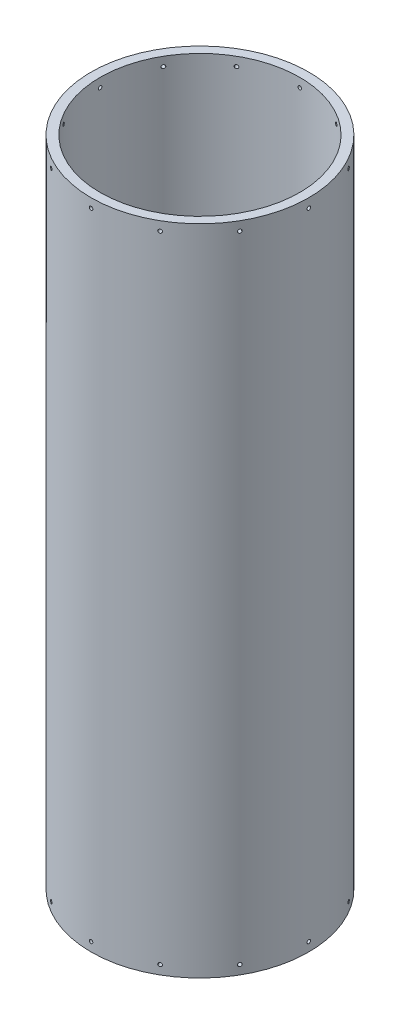
from build123d import *

# Parameters (mm, degrees)
SKETCH1_R                         = 152.4
SKETCH1_R_2                       = 139.7
BOSS_EXTRUDE1_DEPTH               = 914.4
F_10_0_1935_DIAMETER_HOLE1_REACH  = 977.836
F_10_0_1935_DIAMETER_HOLE1_BORE_R = 2.45745
CIRPATTERN1_COUNT                 = 12
MIRROR1_COPY_1_REACH              = 977.836
MIRROR1_COPY_1_SKETCH_R           = 2.45745
MIRROR1_COPY_2_REACH              = 977.836
MIRROR1_COPY_2_SKETCH_R           = 2.45745
MIRROR1_COPY_3_REACH              = 977.836
MIRROR1_COPY_3_SKETCH_R           = 2.45745
MIRROR1_COPY_4_REACH              = 977.836
MIRROR1_COPY_4_SKETCH_R           = 2.45745
MIRROR1_COPY_5_REACH              = 977.836
MIRROR1_COPY_5_SKETCH_R           = 2.45745
MIRROR1_COPY_6_REACH              = 977.836
MIRROR1_COPY_6_SKETCH_R           = 2.45745
MIRROR1_COPY_7_REACH              = 977.836
MIRROR1_COPY_7_SKETCH_R           = 2.45745
MIRROR1_COPY_8_REACH              = 977.836
MIRROR1_COPY_8_SKETCH_R           = 2.45745
MIRROR1_COPY_9_REACH              = 977.836
MIRROR1_COPY_9_SKETCH_R           = 2.45745
MIRROR1_COPY_10_REACH             = 977.836
MIRROR1_COPY_10_SKETCH_R          = 2.45745
MIRROR1_COPY_11_REACH             = 977.836
MIRROR1_COPY_11_SKETCH_R          = 2.45745


with BuildPart() as part:
    # Sketch1 → Boss-Extrude1 (new body)
    with BuildSketch(Plane(origin=(0, 0, 0), x_dir=(1, 0, 0), z_dir=(0, 1, 0))):
        with Locations(Location((0, 0, 0), (0, 0, 270))):
            Circle(SKETCH1_R)
        with Locations(Location((0, 0, 0), (0, 0, 270))):
            Circle(SKETCH1_R_2, mode=Mode.SUBTRACT)
    extrude(amount=BOSS_EXTRUDE1_DEPTH)

    # #10 (0.1935) Diameter Hole1 bore → #10 (0.1935) Diameter Hole1 (cut, up to next)
    with BuildSketch(Plane.ZY.offset(152.4), mode=Mode.PRIVATE) as f_10_0_1935_diameter_hole1_sk1:
        with Locations((0, 901.7)):
            Circle(F_10_0_1935_DIAMETER_HOLE1_BORE_R)
    f_10_0_1935_diameter_hole1_tool1 = extrude(f_10_0_1935_diameter_hole1_sk1.sketch, amount=-F_10_0_1935_DIAMETER_HOLE1_REACH, mode=Mode.PRIVATE) & part.part
    f_10_0_1935_diameter_hole1 = f_10_0_1935_diameter_hole1_tool1.solids().sort_by_distance((-152.4, 901.7, 0))[0]
    add(f_10_0_1935_diameter_hole1, mode=Mode.SUBTRACT)

    # CirPattern1: #10 (0.1935) Diameter Hole1 ×12 about axis
    cirpattern1_axis = Axis((0, 914.4, 0), (0, 1, 0))
    for i in range(1, CIRPATTERN1_COUNT):
        add(f_10_0_1935_diameter_hole1.rotate(cirpattern1_axis, i * 360 / CIRPATTERN1_COUNT), mode=Mode.SUBTRACT)

    # Mirror1: #10 (0.1935) Diameter Hole1 across plane
    add(f_10_0_1935_diameter_hole1.mirror(Plane.ZX.offset(457.2)), mode=Mode.SUBTRACT)

    # Mirror1 copy 1 sketch → Mirror1 copy 1 (cut, up to next)
    with BuildSketch(Plane(origin=(-131.982271537, 914.4, 76.2), x_dir=(0.49999999999999994, 0, 0.8660254037844387), z_dir=(-0.8660254037844387, 0, 0.49999999999999994)), mode=Mode.PRIVATE) as mirror1_copy_1_sk1:
        with Locations((0, -901.7)):
            Circle(MIRROR1_COPY_1_SKETCH_R)
    mirror1_copy_1_tool1 = extrude(mirror1_copy_1_sk1.sketch, amount=-MIRROR1_COPY_1_REACH, mode=Mode.PRIVATE) & part.part
    add(mirror1_copy_1_tool1.solids().sort_by_distance((-131.982271537, 12.7, 76.2))[0], mode=Mode.SUBTRACT)

    # Mirror1 copy 2 sketch → Mirror1 copy 2 (cut, up to next)
    with BuildSketch(Plane(origin=(-76.2, 914.4, 131.982271537), x_dir=(0.8660254037844386, 0, 0.5000000000000001), z_dir=(-0.5000000000000001, 0, 0.8660254037844386)), mode=Mode.PRIVATE) as mirror1_copy_2_sk1:
        with Locations((0, -901.7)):
            Circle(MIRROR1_COPY_2_SKETCH_R)
    mirror1_copy_2_tool1 = extrude(mirror1_copy_2_sk1.sketch, amount=-MIRROR1_COPY_2_REACH, mode=Mode.PRIVATE) & part.part
    add(mirror1_copy_2_tool1.solids().sort_by_distance((-76.2, 12.7, 131.982271537))[0], mode=Mode.SUBTRACT)

    # Mirror1 copy 3 sketch → Mirror1 copy 3 (cut, up to next)
    with BuildSketch(Plane(origin=(0, 914.4, 152.4), x_dir=(1, 0, 0), z_dir=(0, 0, 1)), mode=Mode.PRIVATE) as mirror1_copy_3_sk1:
        with Locations((0, -901.7)):
            Circle(MIRROR1_COPY_3_SKETCH_R)
    mirror1_copy_3_tool1 = extrude(mirror1_copy_3_sk1.sketch, amount=-MIRROR1_COPY_3_REACH, mode=Mode.PRIVATE) & part.part
    add(mirror1_copy_3_tool1.solids().sort_by_distance((0, 12.7, 152.4))[0], mode=Mode.SUBTRACT)

    # Mirror1 copy 4 sketch → Mirror1 copy 4 (cut, up to next)
    with BuildSketch(Plane(origin=(76.2, 914.4, 131.982271537), x_dir=(0.8660254037844387, 0, -0.4999999999999998), z_dir=(0.4999999999999998, 0, 0.8660254037844387)), mode=Mode.PRIVATE) as mirror1_copy_4_sk1:
        with Locations((0, -901.7)):
            Circle(MIRROR1_COPY_4_SKETCH_R)
    mirror1_copy_4_tool1 = extrude(mirror1_copy_4_sk1.sketch, amount=-MIRROR1_COPY_4_REACH, mode=Mode.PRIVATE) & part.part
    add(mirror1_copy_4_tool1.solids().sort_by_distance((76.2, 12.7, 131.982271537))[0], mode=Mode.SUBTRACT)

    # Mirror1 copy 5 sketch → Mirror1 copy 5 (cut, up to next)
    with BuildSketch(Plane(origin=(131.982271537, 914.4, 76.2), x_dir=(0.49999999999999994, 0, -0.8660254037844387), z_dir=(0.8660254037844387, 0, 0.49999999999999994)), mode=Mode.PRIVATE) as mirror1_copy_5_sk1:
        with Locations((0, -901.7)):
            Circle(MIRROR1_COPY_5_SKETCH_R)
    mirror1_copy_5_tool1 = extrude(mirror1_copy_5_sk1.sketch, amount=-MIRROR1_COPY_5_REACH, mode=Mode.PRIVATE) & part.part
    add(mirror1_copy_5_tool1.solids().sort_by_distance((131.982271537, 12.7, 76.2))[0], mode=Mode.SUBTRACT)

    # Mirror1 copy 6 sketch → Mirror1 copy 6 (cut, up to next)
    with BuildSketch(Plane(origin=(152.4, 914.4, 0), x_dir=(0, 0, -1), z_dir=(1, 0, 0)), mode=Mode.PRIVATE) as mirror1_copy_6_sk1:
        with Locations((0, -901.7)):
            Circle(MIRROR1_COPY_6_SKETCH_R)
    mirror1_copy_6_tool1 = extrude(mirror1_copy_6_sk1.sketch, amount=-MIRROR1_COPY_6_REACH, mode=Mode.PRIVATE) & part.part
    add(mirror1_copy_6_tool1.solids().sort_by_distance((152.4, 12.7, 0))[0], mode=Mode.SUBTRACT)

    # Mirror1 copy 7 sketch → Mirror1 copy 7 (cut, up to next)
    with BuildSketch(Plane(origin=(131.982271537, 914.4, -76.2), x_dir=(-0.5000000000000001, 0, -0.8660254037844386), z_dir=(0.8660254037844386, 0, -0.5000000000000001)), mode=Mode.PRIVATE) as mirror1_copy_7_sk1:
        with Locations((0, -901.7)):
            Circle(MIRROR1_COPY_7_SKETCH_R)
    mirror1_copy_7_tool1 = extrude(mirror1_copy_7_sk1.sketch, amount=-MIRROR1_COPY_7_REACH, mode=Mode.PRIVATE) & part.part
    add(mirror1_copy_7_tool1.solids().sort_by_distance((131.982271537, 12.7, -76.2))[0], mode=Mode.SUBTRACT)

    # Mirror1 copy 8 sketch → Mirror1 copy 8 (cut, up to next)
    with BuildSketch(Plane(origin=(76.2, 914.4, -131.982271537), x_dir=(-0.8660254037844384, 0, -0.5000000000000004), z_dir=(0.5000000000000004, 0, -0.8660254037844384)), mode=Mode.PRIVATE) as mirror1_copy_8_sk1:
        with Locations((0, -901.7)):
            Circle(MIRROR1_COPY_8_SKETCH_R)
    mirror1_copy_8_tool1 = extrude(mirror1_copy_8_sk1.sketch, amount=-MIRROR1_COPY_8_REACH, mode=Mode.PRIVATE) & part.part
    add(mirror1_copy_8_tool1.solids().sort_by_distance((76.2, 12.7, -131.982271537))[0], mode=Mode.SUBTRACT)

    # Mirror1 copy 9 sketch → Mirror1 copy 9 (cut, up to next)
    with BuildSketch(Plane(origin=(0, 914.4, -152.4), x_dir=(-1, 0, 0), z_dir=(0, 0, -1)), mode=Mode.PRIVATE) as mirror1_copy_9_sk1:
        with Locations((0, -901.7)):
            Circle(MIRROR1_COPY_9_SKETCH_R)
    mirror1_copy_9_tool1 = extrude(mirror1_copy_9_sk1.sketch, amount=-MIRROR1_COPY_9_REACH, mode=Mode.PRIVATE) & part.part
    add(mirror1_copy_9_tool1.solids().sort_by_distance((0, 12.7, -152.4))[0], mode=Mode.SUBTRACT)

    # Mirror1 copy 10 sketch → Mirror1 copy 10 (cut, up to next)
    with BuildSketch(Plane(origin=(-76.2, 914.4, -131.982271537), x_dir=(-0.8660254037844386, 0, 0.5000000000000001), z_dir=(-0.5000000000000001, 0, -0.8660254037844386)), mode=Mode.PRIVATE) as mirror1_copy_10_sk1:
        with Locations((0, -901.7)):
            Circle(MIRROR1_COPY_10_SKETCH_R)
    mirror1_copy_10_tool1 = extrude(mirror1_copy_10_sk1.sketch, amount=-MIRROR1_COPY_10_REACH, mode=Mode.PRIVATE) & part.part
    add(mirror1_copy_10_tool1.solids().sort_by_distance((-76.2, 12.7, -131.982271537))[0], mode=Mode.SUBTRACT)

    # Mirror1 copy 11 sketch → Mirror1 copy 11 (cut, up to next)
    with BuildSketch(Plane(origin=(-131.982271537, 914.4, -76.2), x_dir=(-0.5000000000000004, 0, 0.8660254037844384), z_dir=(-0.8660254037844384, 0, -0.5000000000000004)), mode=Mode.PRIVATE) as mirror1_copy_11_sk1:
        with Locations((0, -901.7)):
            Circle(MIRROR1_COPY_11_SKETCH_R)
    mirror1_copy_11_tool1 = extrude(mirror1_copy_11_sk1.sketch, amount=-MIRROR1_COPY_11_REACH, mode=Mode.PRIVATE) & part.part
    add(mirror1_copy_11_tool1.solids().sort_by_distance((-131.982271537, 12.7, -76.2))[0], mode=Mode.SUBTRACT)


solid = part.part
